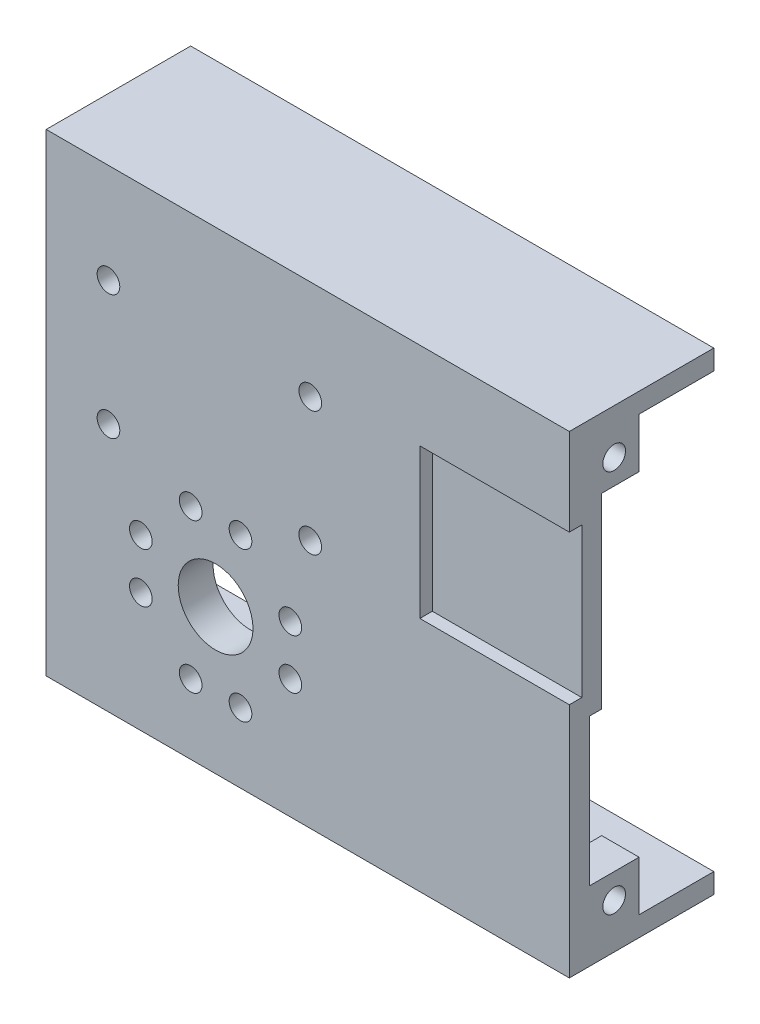
from build123d import *

# Parameters (mm, degrees)
SKETCH_1_W               = 210
SKETCH_1_H               = 190
EXTRUDE_1_DEPTH          = 8
EXTRUDE_2_DEPTH          = 50
SKETCH_3_W               = 20
SKETCH_3_H               = 20
EXTRUDE_3_DEPTH          = 15
SKETCH_8_R               = 4.55
CUT_EXTRUDE_1_DEPTH      = 25
SKETCH_9_W               = 120
SKETCH_9_H               = 100
EXTRUDE_4_DEPTH          = 12
SKETCH_10_R              = 15
CUT_EXTRUDE_2_DEPTH      = 147.608321728
SKETCH_13_R              = 4.55
CUT_EXTRUDE_3_DEPTH      = 154.016338997
PATTERN_CIRCULAR_2_COUNT = 4
SKETCH_14_W              = 120
SKETCH_14_H              = 100
CUT_EXTRUDE_4_DEPTH      = 6
SKETCH_15_W              = 68
SKETCH_15_H              = 76
EXTRUDE_5_DEPTH          = 5
SKETCH_16_W              = 60
SKETCH_16_H              = 60
CUT_EXTRUDE_5_DEPTH      = 5
SKETCH_17_R              = 4.55
CUT_EXTRUDE_6_DEPTH      = 154.016338997
SKETCH_18_W              = 40
SKETCH_18_H              = 20
CUT_EXTRUDE_7_DEPTH      = 6


with BuildPart() as part:
    # 스케치1 → 보스-돌출1 (new body)
    with BuildSketch(Plane.XY):
        Rectangle(SKETCH_1_W, SKETCH_1_H)
    extrude(amount=EXTRUDE_1_DEPTH)

    # 스케치2 → 보스-돌출2 (add)
    with BuildSketch(Plane(origin=(0, 0, 0), x_dir=(-1, 0, 0), z_dir=(0, 0, -1))):
        Polygon((-105, 95), (105, 95), (105, -95), (-105, -95), (-105, -87), (97, -87), (97, 87), (-105, 87), align=None)
    extrude(amount=EXTRUDE_2_DEPTH)

    # 스케치3 → 보스-돌출3 (add)
    with BuildSketch(Plane(origin=(105, 0, 0), x_dir=(0, 0, -1), z_dir=(1, 0, 0))):
        with Locations((10, 77)):
            Rectangle(SKETCH_3_W, SKETCH_3_H)
    extrude_3 = extrude(amount=-EXTRUDE_3_DEPTH)

    # 스케치8 → 컷-돌출1 (cut)
    with BuildSketch(Plane(origin=(105, 0, 0), x_dir=(0, 0, -1), z_dir=(1, 0, 0))):
        with Locations(Location((10, 77, 0), (0, 0, 90))):
            Circle(SKETCH_8_R)
    cut_extrude_1 = extrude(amount=-CUT_EXTRUDE_1_DEPTH, mode=Mode.SUBTRACT)

    # 대칭 복사1: 보스-돌출3, 컷-돌출1 across plane
    add(extrude_3.mirror(Plane(origin=(0, 0, 0), x_dir=(0, 0, 1), z_dir=(0, -1, 0))))
    add(cut_extrude_1.mirror(Plane(origin=(0, 0, 0), x_dir=(0, 0, 1), z_dir=(0, -1, 0))), mode=Mode.SUBTRACT)

    # 스케치9 → 보스-돌출4 (add)
    with BuildSketch(Plane(origin=(0, 0, 0), x_dir=(-1, 0, 0), z_dir=(0, 0, -1))):
        with Locations((37, -37)):
            Rectangle(SKETCH_9_W, SKETCH_9_H)
    extrude(amount=EXTRUDE_4_DEPTH)

    # 스케치10 → 컷-돌출2 (cut, through all)
    with BuildSketch(Plane(origin=(0, 0, -12), x_dir=(-1, 0, 0), z_dir=(0, 0, -1))):
        with Locations((37, -37)):
            Circle(SKETCH_10_R)
    extrude(amount=-CUT_EXTRUDE_2_DEPTH, mode=Mode.SUBTRACT)

    # 스케치13 → 컷-돌출3 (cut, through all)
    with BuildSketch(Plane.XY.offset(8)):
        with Locations((-47, -7)):
            Circle(SKETCH_13_R)
        with Locations((-27, -7)):
            Circle(SKETCH_13_R)
    cut_extrude_3 = extrude(amount=-CUT_EXTRUDE_3_DEPTH, mode=Mode.SUBTRACT)

    # 원형 패턴2: 컷-돌출3 ×4 about axis
    pattern_circular_2_axis = Axis((-37, -37, 0), (0, 0, 1))
    for i in range(1, PATTERN_CIRCULAR_2_COUNT):
        add(cut_extrude_3.rotate(pattern_circular_2_axis, i * 360 / PATTERN_CIRCULAR_2_COUNT), mode=Mode.SUBTRACT)

    # 스케치14 → 컷-돌출4 (cut)
    with BuildSketch(Plane(origin=(0, 0, -12), x_dir=(-1, 0, 0), z_dir=(0, 0, -1))):
        with Locations((37, -37)):
            Rectangle(SKETCH_14_W, SKETCH_14_H)
    extrude(amount=-CUT_EXTRUDE_4_DEPTH, mode=Mode.SUBTRACT)

    # 스케치15 → 보스-돌출5 (add)
    with BuildSketch(Plane(origin=(0, 0, 0), x_dir=(-1, 0, 0), z_dir=(0, 0, -1))):
        with Locations((-71, 30)):
            Rectangle(SKETCH_15_W, SKETCH_15_H)
    extrude(amount=EXTRUDE_5_DEPTH)

    # 스케치16 → 컷-돌출5 (cut)
    with BuildSketch(Plane.XY.offset(8)):
        with Locations((75, 30)):
            Rectangle(SKETCH_16_W, SKETCH_16_H)
    extrude(amount=-CUT_EXTRUDE_5_DEPTH, mode=Mode.SUBTRACT)

    # 스케치17 → 컷-돌출6 (cut, through all)
    with BuildSketch(Plane.XY.offset(8)):
        with Locations((1, 5.05)):
            Circle(SKETCH_17_R)
        with Locations((-80, 5.05)):
            Circle(SKETCH_17_R)
        with Locations((-80, 55.05)):
            Circle(SKETCH_17_R)
        with Locations((1, 55.05)):
            Circle(SKETCH_17_R)
    extrude(amount=-CUT_EXTRUDE_6_DEPTH, mode=Mode.SUBTRACT)

    # 스케치18 → 컷-돌출7 (cut)
    with BuildSketch(Plane(origin=(0, 0, -6), x_dir=(-1, 0, 0), z_dir=(0, 0, -1))):
        with Locations((-3, 3)):
            Rectangle(SKETCH_18_W, SKETCH_18_H)
        with Locations((77, 3)):
            Rectangle(SKETCH_18_W, SKETCH_18_H)
    extrude(amount=-CUT_EXTRUDE_7_DEPTH, mode=Mode.SUBTRACT)


solid = part.part
